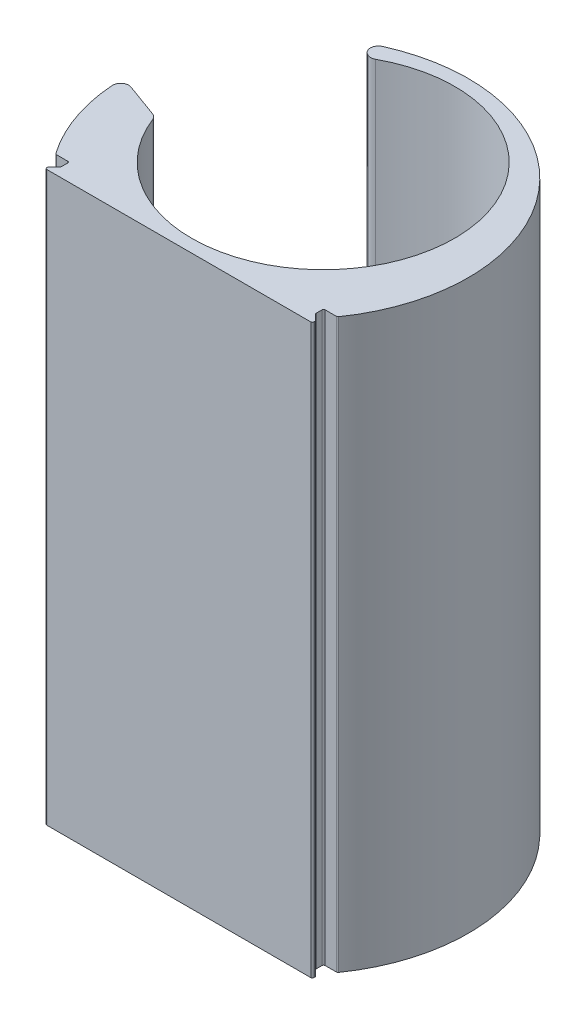
from build123d import *

# Parameters (mm, degrees)
SKETCH1_R           = 16.4
BOSS_EXTRUDE1_DEPTH = 70
BOSS_EXTRUDE2_START = 0.8
BOSS_EXTRUDE2_DEPTH = 0.8
CUT_EXTRUDE1_DEPTH  = 64
FILLET1_R           = 1
FILLET2_R           = 0.2


with BuildPart() as part:
    # Sketch1 → Boss-Extrude1 (new body)
    with BuildSketch(Plane(origin=(0, 0, 0), x_dir=(1, 0, 0), z_dir=(0, 1, 0))):
        with BuildLine():
            Line((-18.386301809, -27.686071188), (-20.098433843, -27.686071188))
            Line((-20.098433843, -27.686071188), (-20.098433843, -28.698203222))
            Line((-20.098433843, -28.698203222), (-19.298433843, -29.498203222))
            Line((-19.298433843, -29.498203222), (-19.298433843, -29.886071188))
            Line((-19.298433843, -29.886071188), (-52.598433843, -29.886071188))
            Line((-52.598433843, -29.886071188), (-52.598433843, -29.498203222))
            Line((-52.598433843, -29.498203222), (-51.798433843, -28.698203222))
            Line((-51.798433843, -28.698203222), (-51.798433843, -27.686071188))
            Line((-51.798433843, -27.686071188), (-53.510565878, -27.686071188))
            ThreePointArc((-53.510565878, -27.686071188), (-35.948433843, 6.216409145), (-18.386301809, -27.686071188))
        make_face()
        with Locations(Location((-35.948433843, -11.886071188, 0), (0, 0, 270))):
            Circle(SKETCH1_R, mode=Mode.SUBTRACT)
    extrude(amount=BOSS_EXTRUDE1_DEPTH)

    # Sketch2 → Boss-Extrude2 (add)
    with BuildSketch(Plane.XZ.offset(BOSS_EXTRUDE2_START)):
        with BuildLine():
            Line((-18.386301809, 27.686071188), (-20.098433843, 27.686071188))
            Line((-20.098433843, 27.686071188), (-20.098433843, 28.698203222))
            Line((-20.098433843, 28.698203222), (-19.298433843, 29.498203222))
            Line((-19.298433843, 29.498203222), (-19.298433843, 29.886071188))
            Line((-19.298433843, 29.886071188), (-52.598433843, 29.886071188))
            Line((-52.598433843, 29.886071188), (-52.598433843, 29.498203222))
            Line((-52.598433843, 29.498203222), (-51.798433843, 28.698203222))
            Line((-51.798433843, 28.698203222), (-51.798433843, 27.686071188))
            Line((-51.798433843, 27.686071188), (-53.510565878, 27.686071188))
            ThreePointArc((-53.510565878, 27.686071188), (-35.948433843, -6.216409145), (-18.386301809, 27.686071188))
        make_face()
    extrude(amount=-BOSS_EXTRUDE2_DEPTH)

    # Sketch3 → Cut-Extrude1 (cut)
    with BuildSketch(Plane(origin=(0, 70, 0), x_dir=(1, 0, 0), z_dir=(0, 1, 0))):
        Polygon((-49.615972348, -18.085360607), (-42.433549338, 1.648184429), (-57.414050135, 7.100640814), (-64.596473145, -12.632904223), align=None)
    extrude(amount=-CUT_EXTRUDE1_DEPTH, mode=Mode.SUBTRACT)

    # Fillet1
    fillet1_edges = [part.edges().sort_by_distance(p)[0] for p in [
        (-44.195484744, 38, -2.289476472),
        (-51.377907754, 38, 17.444068565),
        (-57.448378022, 38, 15.234598079),
        (-46.841576343, 38, -3.252575051),
    ]]
    fillet(fillet1_edges, radius=FILLET1_R)

    # Fillet2
    fillet2_edges = [part.edges().sort_by_distance(p)[0] for p in [
        (-18.386301809, 34.6, 27.686071188),
        (-20.098433843, 34.6, 27.686071188),
        (-20.098433843, 34.6, 28.698203222),
        (-19.298433843, 34.6, 29.498203222),
        (-19.298433843, 34.6, 29.886071188),
        (-52.598433843, 34.6, 29.886071188),
        (-52.598433843, 34.6, 29.498203222),
        (-51.798433843, 34.6, 28.698203222),
        (-51.798433843, 34.6, 27.686071188),
        (-53.510565878, 34.6, 27.686071188),
    ]]
    fillet(fillet2_edges, radius=FILLET2_R)


solid = part.part
